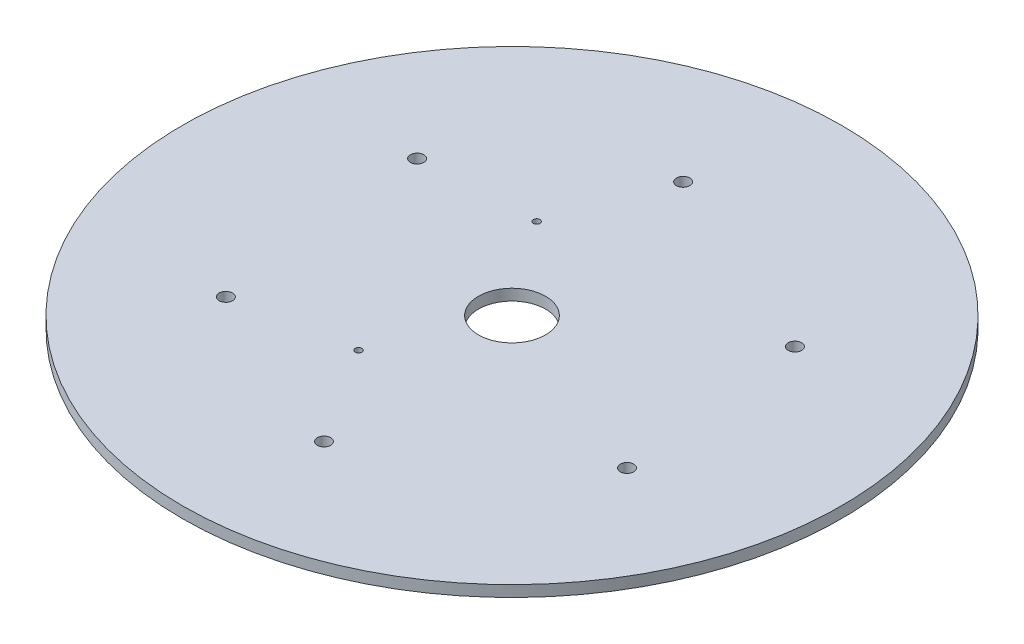
from build123d import *

# Parameters (mm, degrees)
ESQUISSE1_R        = 147.5
ESQUISSE1_R_2      = 15
ESQUISSE1_R_3      = 3
ESQUISSE1_R_4      = 1.5
BOSS_EXTRU_1_DEPTH = 5


with BuildPart() as part:
    # Esquisse1 → Boss.-Extru.1 (new body)
    with BuildSketch(Plane(origin=(0, 0, 0), x_dir=(1, 0, 0), z_dir=(0, 1, 0))):
        with Locations(Location((0, 0, 0), (0, 0, 270))):
            Circle(ESQUISSE1_R)
        with Locations(Location((0, 0, 0), (0, 0, 270))):
            Circle(ESQUISSE1_R_2, mode=Mode.SUBTRACT)
        with Locations(Location((-13.540108487, 90.127070907, 0), (0, 0, 270))):
            Circle(ESQUISSE1_R_3, mode=Mode.SUBTRACT)
        with Locations(Location((-82.082198921, 39.607272923, 0), (0, 0, 270))):
            Circle(ESQUISSE1_R_3, mode=Mode.SUBTRACT)
        with Locations(Location((75.342010962, 51.281622754, 0), (0, 0, 270))):
            Circle(ESQUISSE1_R_3, mode=Mode.SUBTRACT)
        with Locations(Location((84.822389485, -33.337451765, 0), (0, 0, 270))):
            Circle(ESQUISSE1_R_3, mode=Mode.SUBTRACT)
        with Locations(Location((6.740188753, -90.888906384, 0), (0, 0, 270))):
            Circle(ESQUISSE1_R_3, mode=Mode.SUBTRACT)
        with Locations(Location((-71.282271006, -56.78962307, 0), (0, 0, 270))):
            Circle(ESQUISSE1_R_3, mode=Mode.SUBTRACT)
        with Locations(Location((-20.889727943, -47.797718878, 0), (0, 0, 270))):
            Circle(ESQUISSE1_R_4, mode=Mode.SUBTRACT)
        with Locations(Location((-30.949170814, 41.989892072, 0), (0, 0, 270))):
            Circle(ESQUISSE1_R_4, mode=Mode.SUBTRACT)
    extrude(amount=BOSS_EXTRU_1_DEPTH)


solid = part.part
